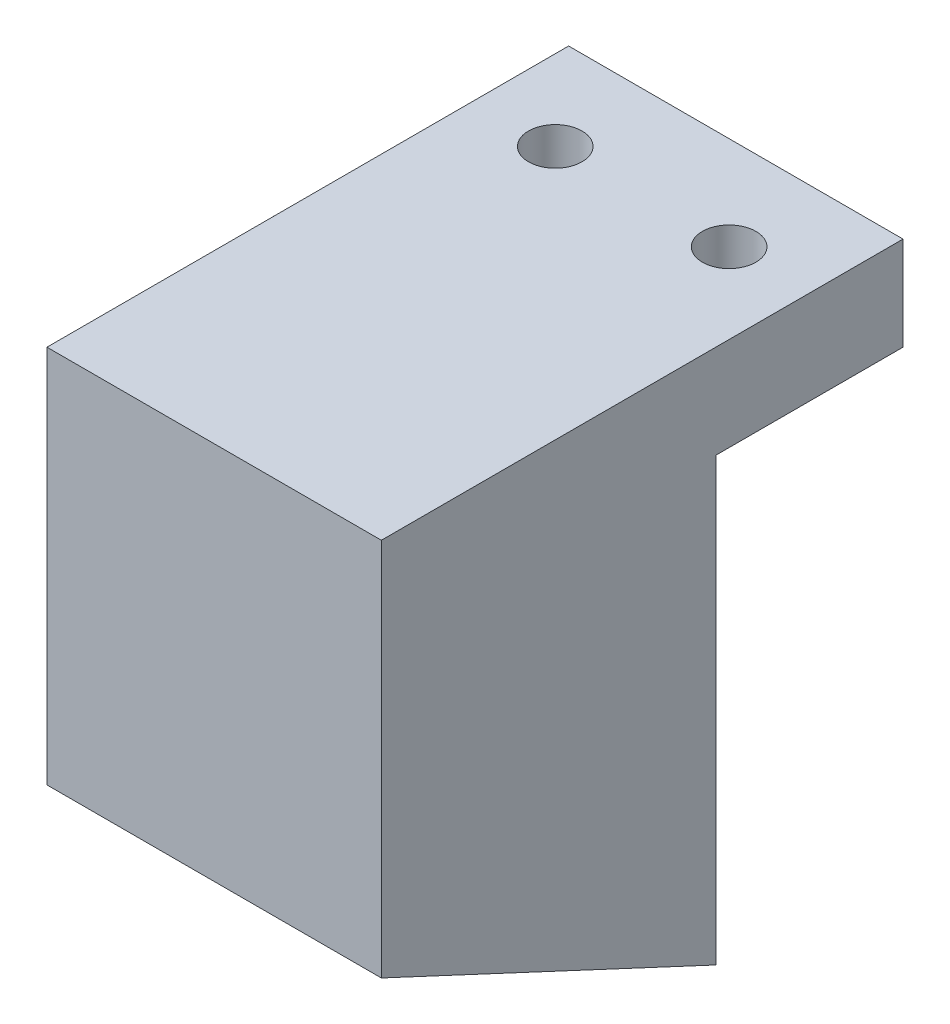
from build123d import *

# Parameters (mm, degrees)
SKETCH1_W           = 25
SKETCH1_H           = 25
BOSS_EXTRUDE1_DEPTH = 40
CUT_EXTRUDE1_DEPTH  = 40
SKETCH3_R           = 1.5
CUT_EXTRUDE2_DEPTH  = 36
SKETCH4_W           = 25
SKETCH4_H           = 7
BOSS_EXTRUDE2_DEPTH = 14
SKETCH5_R           = 2
CUT_EXTRUDE3_DEPTH  = 14


with BuildPart() as part:
    # Sketch1 → Boss-Extrude1 (new body)
    with BuildSketch(Plane(origin=(0, 0, 0), x_dir=(1, 0, 0), z_dir=(0, 1, 0))):
        with Locations((-64.404761905, 3.571428571)):
            Rectangle(SKETCH1_W, SKETCH1_H)
    extrude(amount=BOSS_EXTRUDE1_DEPTH)

    # Sketch2 → Cut-Extrude1 (cut)
    with BuildSketch(Plane(origin=(-51.904761905, 0, 0), x_dir=(0, 0, -1), z_dir=(1, 0, 0))):
        Polygon((16.071428571, 0), (-8.928571429, 0), (-8.928571429, 11.657691454), align=None)
    extrude(amount=-CUT_EXTRUDE1_DEPTH, mode=Mode.SUBTRACT)

    # Sketch3 → Cut-Extrude2 (cut)
    with BuildSketch(Plane(origin=(0, 6.155714275, -2.870456708), x_dir=(1, 0, 0), z_dir=(0, -0.9063077870366528, 0.4226182617406934))):
        with Locations(Location((-64.404761905, -0.771212889, 0), (0, 0, 270))):
            Circle(SKETCH3_R)
    extrude(amount=-CUT_EXTRUDE2_DEPTH, mode=Mode.SUBTRACT)

    # Sketch4 → Boss-Extrude2 (add)
    with BuildSketch(Plane(origin=(0, 0, -16.071428571), x_dir=(-1, 0, 0), z_dir=(0, 0, -1))):
        with Locations((64.404761905, 36.5)):
            Rectangle(SKETCH4_W, SKETCH4_H)
    extrude(amount=BOSS_EXTRUDE2_DEPTH)

    # Sketch5 → Cut-Extrude3 (cut)
    with BuildSketch(Plane(origin=(0, 33, 0), x_dir=(-1, 0, 0), z_dir=(0, -1, 0))):
        with Locations(Location((70.904761905, 23.071428571, 0), (0, 0, 90))):
            Circle(SKETCH5_R)
        with Locations(Location((57.904761905, 23.071428571, 0), (0, 0, 90))):
            Circle(SKETCH5_R)
    extrude(amount=-CUT_EXTRUDE3_DEPTH, mode=Mode.SUBTRACT)


solid = part.part
